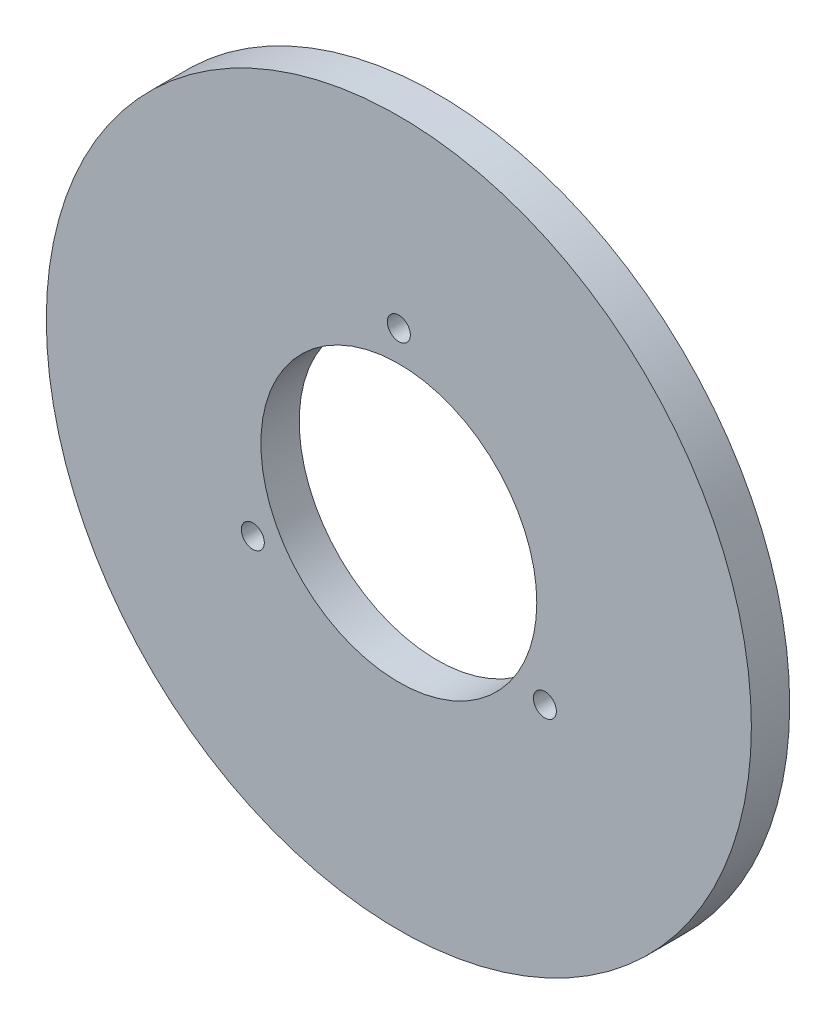
from build123d import *

# Parameters (mm, degrees)
SKETCH2_R               = 46
SKETCH2_R_2             = 18
BOSS_EXTRUDE2_DEPTH     = 5
CUT_EXTRUDE1_DEPTH      = 66.245689513
CUT_EXTRUDE1_DEPTH_BACK = 66.245689513
SKETCH5_R               = 1.5


with BuildPart() as part:
    # Sketch2 → Boss-Extrude2 (new body)
    with BuildSketch(Plane.XY):
        Circle(SKETCH2_R)
        Circle(SKETCH2_R_2, mode=Mode.SUBTRACT)
    extrude(amount=BOSS_EXTRUDE2_DEPTH)

    # Sketch5 → Cut-Extrude1 (cut, two sides: drawn at the far end of the back side and taken through both)
    with BuildSketch(Plane(origin=(0, 0, 0), x_dir=(-1, 0, 0), z_dir=(0, 0, -1)).offset(-CUT_EXTRUDE1_DEPTH_BACK)):
        with Locations((0, 22)):
            Circle(SKETCH5_R)
        with Locations((19.052558883, -11)):
            Circle(SKETCH5_R)
        with Locations((-19.052558883, -11)):
            Circle(SKETCH5_R)
    extrude(amount=CUT_EXTRUDE1_DEPTH + CUT_EXTRUDE1_DEPTH_BACK, mode=Mode.SUBTRACT)


solid = part.part
